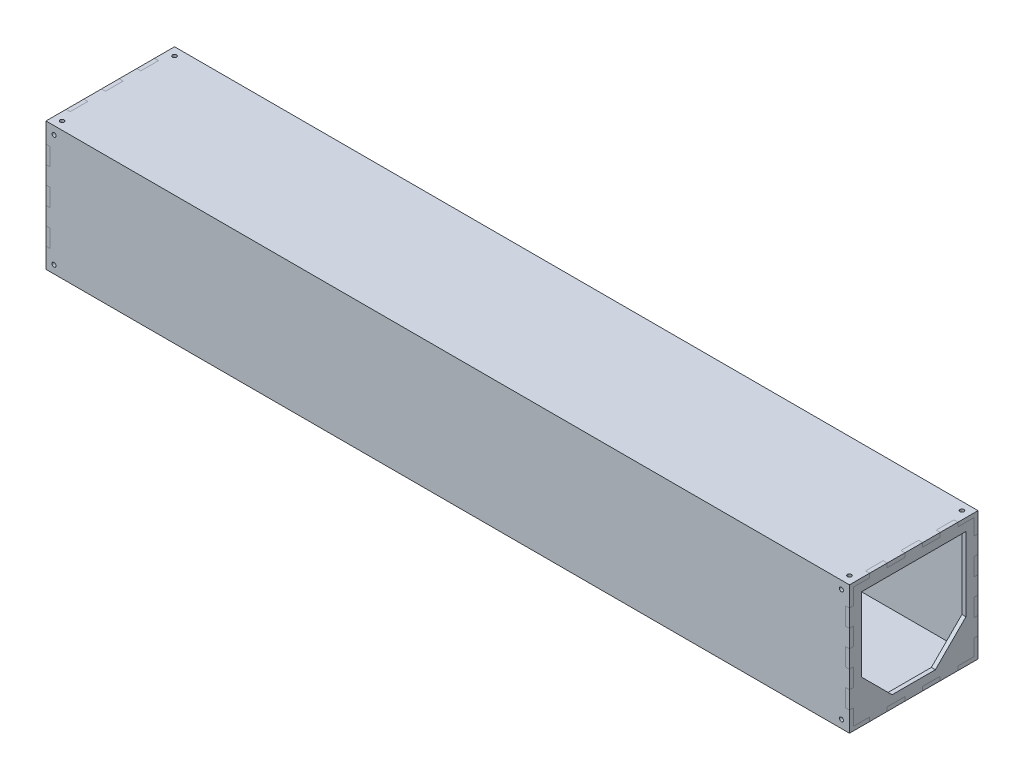
from build123d import *

# Parameters (mm, degrees)
SKETCH1_W           = 101.6
SKETCH1_H           = 101.6
SKETCH1_W_2         = 95.25
SKETCH1_H_2         = 95.25
BOSS_EXTRUDE1_DEPTH = 628.65
SKETCH3_W           = 13.97
SKETCH3_H           = 3.175
SKETCH3_W_2         = 3.175
SKETCH3_H_2         = 13.97
BOSS_EXTRUDE3_DEPTH = 3.175
SKETCH4_W           = 13.97
SKETCH4_H           = 3.175
SKETCH4_W_2         = 3.175
SKETCH4_H_2         = 13.97
BOSS_EXTRUDE4_DEPTH = 3.175
SKETCH5_W           = 95.25
SKETCH5_H           = 95.25
SKETCH5_W_2         = 3.175
SKETCH5_H_2         = 13.97
SKETCH5_W_3         = 13.97
SKETCH5_H_3         = 3.175
BOSS_EXTRUDE5_DEPTH = 3.175
SKETCH6_W           = 3.175
SKETCH6_H           = 13.97
SKETCH6_W_2         = 13.97
SKETCH6_H_2         = 3.175
BOSS_EXTRUDE6_DEPTH = 3.175
SKETCH7_R           = 1.5875
CUT_EXTRUDE1_DEPTH  = 648.956750582
SKETCH8_R           = 1.5875
CUT_EXTRUDE2_DEPTH  = 648.956750582


with BuildPart() as part:
    # Sketch1 → Boss-Extrude1 (new body)
    with BuildSketch(Plane(origin=(0, 0, 0), x_dir=(0, 0, -1), z_dir=(1, 0, 0))):
        with Locations((-50.8, 50.8)):
            Rectangle(SKETCH1_W, SKETCH1_H)
        with Locations((-50.8, 50.8)):
            Rectangle(SKETCH1_W_2, SKETCH1_H_2, mode=Mode.SUBTRACT)
    extrude(amount=BOSS_EXTRUDE1_DEPTH)

    # Sketch3 → Boss-Extrude3 (add)
    with BuildSketch(Plane.ZY):
        Polygon((0, 85.725), (3.175, 85.725), (3.175, 98.425), (15.875, 98.425), (15.875, 101.6), (0, 101.6), align=None)
        with Locations((36.83, 100.0125)):
            Rectangle(SKETCH3_W, SKETCH3_H)
        with Locations((1.5875, 64.77)):
            Rectangle(SKETCH3_W_2, SKETCH3_H_2)
        with Locations((100.0125, 64.77)):
            Rectangle(SKETCH3_W_2, SKETCH3_H_2)
        with Locations((64.77, 100.0125)):
            Rectangle(SKETCH3_W, SKETCH3_H)
        Polygon((98.425, 98.425), (85.725, 98.425), (85.725, 101.6), (101.6, 101.6), (101.6, 85.725), (98.425, 85.725), align=None)
        Polygon((101.6, 15.875), (98.425, 15.875), (98.425, 3.175), (85.725, 3.175), (85.725, 0), (101.6, 0), align=None)
        with Locations((64.77, 1.5875)):
            Rectangle(SKETCH3_W, SKETCH3_H)
        with Locations((100.0125, 36.83)):
            Rectangle(SKETCH3_W_2, SKETCH3_H_2)
        with Locations((1.5875, 36.83)):
            Rectangle(SKETCH3_W_2, SKETCH3_H_2)
        with Locations((36.83, 1.5875)):
            Rectangle(SKETCH3_W, SKETCH3_H)
        Polygon((3.175, 3.175), (15.875, 3.175), (15.875, 0), (0, 0), (0, 15.875), (3.175, 15.875), align=None)
    extrude(amount=BOSS_EXTRUDE3_DEPTH)

    # Sketch6 → Boss-Extrude6 (add)
    with BuildSketch(Plane(origin=(628.65, 0, 0), x_dir=(0, 0, -1), z_dir=(1, 0, 0))):
        with Locations((-100.0125, 36.83)):
            Rectangle(SKETCH6_W, SKETCH6_H)
        with Locations((-100.0125, 64.77)):
            Rectangle(SKETCH6_W, SKETCH6_H)
        Polygon((-98.425, 98.425), (-98.425, 85.725), (-101.6, 85.725), (-101.6, 101.6), (-85.725, 101.6), (-85.725, 98.425), align=None)
        with Locations((-64.77, 100.0125)):
            Rectangle(SKETCH6_W_2, SKETCH6_H_2)
        with Locations((-36.83, 100.0125)):
            Rectangle(SKETCH6_W_2, SKETCH6_H_2)
        Polygon((0, 101.6), (0, 85.725), (-3.175, 85.725), (-3.175, 98.425), (-15.875, 98.425), (-15.875, 101.6), align=None)
        with Locations((-1.5875, 64.77)):
            Rectangle(SKETCH6_W, SKETCH6_H)
        with Locations((-1.5875, 36.83)):
            Rectangle(SKETCH6_W, SKETCH6_H)
        Polygon((-3.175, 3.175), (-3.175, 15.875), (0, 15.875), (0, 0), (-15.875, 0), (-15.875, 3.175), align=None)
        with Locations((-36.83, 1.5875)):
            Rectangle(SKETCH6_W_2, SKETCH6_H_2)
        with Locations((-64.77, 1.5875)):
            Rectangle(SKETCH6_W_2, SKETCH6_H_2)
        Polygon((-101.6, 0), (-101.6, 15.875), (-98.425, 15.875), (-98.425, 3.175), (-85.725, 3.175), (-85.725, 0), align=None)
    extrude(amount=BOSS_EXTRUDE6_DEPTH)

    # Sketch7 → Cut-Extrude1 (cut, through all)
    with BuildSketch(Plane(origin=(0, 0, 0), x_dir=(-1, 0, 0), z_dir=(0, 0, -1))):
        with Locations((-625.475, 95.25)):
            Circle(SKETCH7_R)
        with Locations((-625.475, 6.35)):
            Circle(SKETCH7_R)
        with Locations((-3.175, 95.25)):
            Circle(SKETCH7_R)
        with Locations((-3.175, 6.35)):
            Circle(SKETCH7_R)
    extrude(amount=-CUT_EXTRUDE1_DEPTH, mode=Mode.SUBTRACT)

    # Sketch8 → Cut-Extrude2 (cut, through all)
    with BuildSketch(Plane(origin=(0, 101.6, 0), x_dir=(1, 0, 0), z_dir=(0, 1, 0))):
        with Locations(Location((3.175, -6.35, 0), (0, 0, 270))):
            Circle(SKETCH8_R)
        with Locations(Location((625.475, -6.35, 0), (0, 0, 90))):
            Circle(SKETCH8_R)
        with Locations(Location((625.475, -95.25, 0), (0, 0, 270))):
            Circle(SKETCH8_R)
        with Locations(Location((3.175, -95.25, 0), (0, 0, 90))):
            Circle(SKETCH8_R)
    extrude(amount=-CUT_EXTRUDE2_DEPTH, mode=Mode.SUBTRACT)


with BuildPart() as body_2:
    # Sketch4 → Boss-Extrude4 (new body)
    with BuildSketch(Plane.ZY):
        with Locations((22.86, 100.0125)):
            Rectangle(SKETCH4_W, SKETCH4_H)
        Polygon((3.175, 85.725), (3.175, 98.425), (15.875, 98.425), (29.845, 98.425), (43.815, 98.425), (57.785, 98.425), (71.755, 98.425), (85.725, 98.425), (98.425, 98.425), (98.425, 85.725), (98.425, 71.755), (98.425, 57.785), (98.425, 43.815), (98.425, 29.845), (98.425, 15.875), (98.425, 3.175), (85.725, 3.175), (71.755, 3.175), (57.785, 3.175), (43.815, 3.175), (29.845, 3.175), (15.875, 3.175), (3.175, 3.175), (3.175, 15.875), (3.175, 29.845), (3.175, 43.815), (3.175, 57.785), (3.175, 71.755), align=None)
        with Locations((50.8, 100.0125)):
            Rectangle(SKETCH4_W, SKETCH4_H)
        with Locations((78.74, 100.0125)):
            Rectangle(SKETCH4_W, SKETCH4_H)
        with Locations((100.0125, 78.74)):
            Rectangle(SKETCH4_W_2, SKETCH4_H_2)
        with Locations((100.0125, 50.8)):
            Rectangle(SKETCH4_W_2, SKETCH4_H_2)
        with Locations((100.0125, 22.86)):
            Rectangle(SKETCH4_W_2, SKETCH4_H_2)
        with Locations((78.74, 1.5875)):
            Rectangle(SKETCH4_W, SKETCH4_H)
        with Locations((50.8, 1.5875)):
            Rectangle(SKETCH4_W, SKETCH4_H)
        with Locations((22.86, 1.5875)):
            Rectangle(SKETCH4_W, SKETCH4_H)
        with Locations((1.5875, 22.86)):
            Rectangle(SKETCH4_W_2, SKETCH4_H_2)
        with Locations((1.5875, 50.8)):
            Rectangle(SKETCH4_W_2, SKETCH4_H_2)
        with Locations((1.5875, 78.74)):
            Rectangle(SKETCH4_W_2, SKETCH4_H_2)
    extrude(amount=BOSS_EXTRUDE4_DEPTH)


with BuildPart() as body_3:
    # Sketch5 → Boss-Extrude5 (new body)
    # profile 1 of 13: a face of its own
    with BuildSketch(Plane(origin=(628.65, 0, 0), x_dir=(0, 0, -1), z_dir=(1, 0, 0))):
        with Locations((-50.8, 50.8)):
            Rectangle(SKETCH5_W, SKETCH5_H)
        Polygon((-92.075, 92.075), (-9.525, 92.075), (-9.525, 33.703335213), (-33.703335213, 9.525), (-67.896664787, 9.525), (-92.075, 33.703335213), align=None, mode=Mode.SUBTRACT)
    # profile 2 of 13: a face of its own
    with BuildSketch(Plane(origin=(628.65, 0, 0), x_dir=(0, 0, -1), z_dir=(1, 0, 0))):
        with Locations((-100.0125, 22.86)):
            Rectangle(SKETCH5_W_2, SKETCH5_H_2)
    # profile 3 of 13: a face of its own
    with BuildSketch(Plane(origin=(628.65, 0, 0), x_dir=(0, 0, -1), z_dir=(1, 0, 0))):
        with Locations((-100.0125, 50.8)):
            Rectangle(SKETCH5_W_2, SKETCH5_H_2)
    # profile 4 of 13: a face of its own
    with BuildSketch(Plane(origin=(628.65, 0, 0), x_dir=(0, 0, -1), z_dir=(1, 0, 0))):
        with Locations((-100.0125, 78.74)):
            Rectangle(SKETCH5_W_2, SKETCH5_H_2)
    # profile 5 of 13: a face of its own
    with BuildSketch(Plane(origin=(628.65, 0, 0), x_dir=(0, 0, -1), z_dir=(1, 0, 0))):
        with Locations((-78.74, 100.0125)):
            Rectangle(SKETCH5_W_3, SKETCH5_H_3)
    # profile 6 of 13: a face of its own
    with BuildSketch(Plane(origin=(628.65, 0, 0), x_dir=(0, 0, -1), z_dir=(1, 0, 0))):
        with Locations((-50.8, 100.0125)):
            Rectangle(SKETCH5_W_3, SKETCH5_H_3)
    # profile 7 of 13: a face of its own
    with BuildSketch(Plane(origin=(628.65, 0, 0), x_dir=(0, 0, -1), z_dir=(1, 0, 0))):
        with Locations((-22.86, 100.0125)):
            Rectangle(SKETCH5_W_3, SKETCH5_H_3)
    # profile 8 of 13: a face of its own
    with BuildSketch(Plane(origin=(628.65, 0, 0), x_dir=(0, 0, -1), z_dir=(1, 0, 0))):
        with Locations((-1.5875, 78.74)):
            Rectangle(SKETCH5_W_2, SKETCH5_H_2)
    # profile 9 of 13: a face of its own
    with BuildSketch(Plane(origin=(628.65, 0, 0), x_dir=(0, 0, -1), z_dir=(1, 0, 0))):
        with Locations((-1.5875, 50.8)):
            Rectangle(SKETCH5_W_2, SKETCH5_H_2)
    # profile 10 of 13: a face of its own
    with BuildSketch(Plane(origin=(628.65, 0, 0), x_dir=(0, 0, -1), z_dir=(1, 0, 0))):
        with Locations((-1.5875, 22.86)):
            Rectangle(SKETCH5_W_2, SKETCH5_H_2)
    # profile 11 of 13: a face of its own
    with BuildSketch(Plane(origin=(628.65, 0, 0), x_dir=(0, 0, -1), z_dir=(1, 0, 0))):
        with Locations((-22.86, 1.5875)):
            Rectangle(SKETCH5_W_3, SKETCH5_H_3)
    # profile 12 of 13: a face of its own
    with BuildSketch(Plane(origin=(628.65, 0, 0), x_dir=(0, 0, -1), z_dir=(1, 0, 0))):
        with Locations((-50.8, 1.5875)):
            Rectangle(SKETCH5_W_3, SKETCH5_H_3)
    # profile 13 of 13: a face of its own
    with BuildSketch(Plane(origin=(628.65, 0, 0), x_dir=(0, 0, -1), z_dir=(1, 0, 0))):
        with Locations((-78.74, 1.5875)):
            Rectangle(SKETCH5_W_3, SKETCH5_H_3)
    extrude(amount=BOSS_EXTRUDE5_DEPTH)


solid = Compound([part.part, body_2.part, body_3.part])
